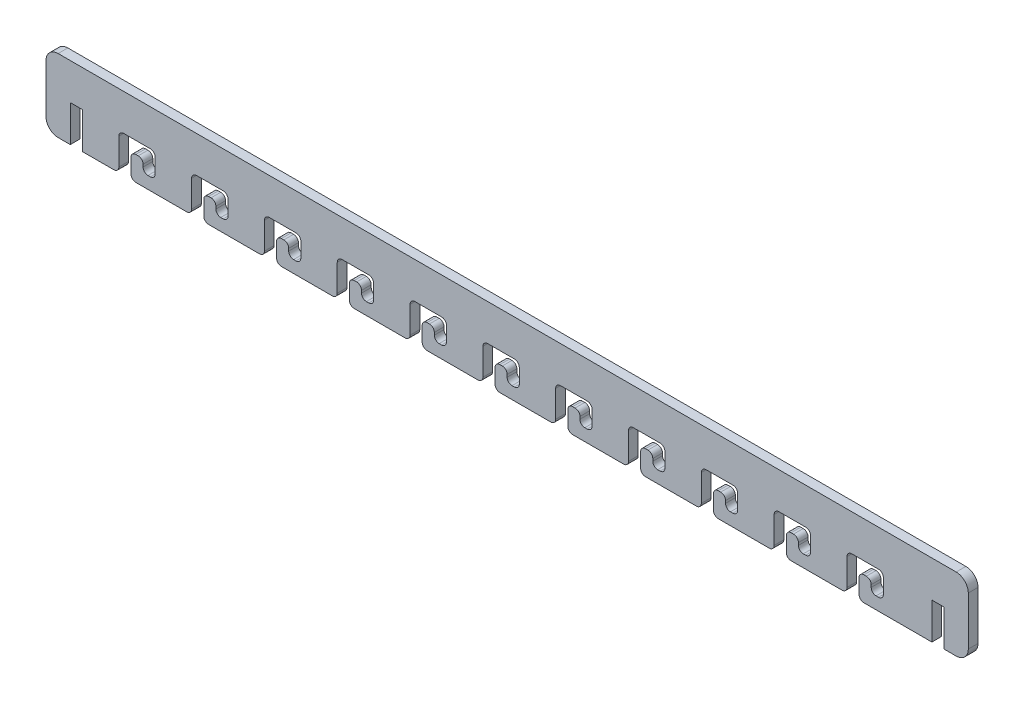
from build123d import *

# Parameters (mm, degrees)
BOSS_EXTRUDE1_DEPTH = 4


with BuildPart() as part:
    # Sketch1 → Boss-Extrude1 (new body)
    with BuildSketch(Plane.XY):
        with BuildLine():
            Line((5, 0), (10, 0))
            Line((10, 0), (10, 15))
            Line((10, 15), (15, 15))
            Line((15, 15), (15, 0))
            Line((15, 0), (28, 0))
            ThreePointArc((28, 0), (29.414213562, 0.585786438), (30, 2))
            Line((30, 2), (30, 13))
            ThreePointArc((30, 13), (30.585786438, 14.414213562), (32, 15))
            Line((32, 15), (43, 15))
            ThreePointArc((43, 15), (44.414213562, 14.414213562), (45, 13))
            Line((45, 13), (45, 7))
            ThreePointArc((45, 7), (44.414213562, 5.585786438), (43, 5))
            Line((43, 5), (42, 5))
            ThreePointArc((42, 5), (40.585786438, 5.585786438), (40, 7))
            Line((40, 7), (40, 8))
            ThreePointArc((40, 8), (39.414213562, 9.414213562), (38, 10))
            Line((38, 10), (37, 10))
            ThreePointArc((37, 10), (35.585786438, 9.414213562), (35, 8))
            Line((35, 8), (35, 2))
            ThreePointArc((35, 2), (35.585786438, 0.585786438), (37, 0))
            Line((37, 0), (58, 0))
            ThreePointArc((58, 0), (59.414213562, 0.585786438), (60, 2))
            Line((60, 2), (60, 13))
            ThreePointArc((60, 13), (60.585786438, 14.414213562), (62, 15))
            Line((62, 15), (73, 15))
            ThreePointArc((73, 15), (74.414213562, 14.414213562), (75, 13))
            Line((75, 13), (75, 7))
            ThreePointArc((75, 7), (74.414213562, 5.585786438), (73, 5))
            Line((73, 5), (72, 5))
            ThreePointArc((72, 5), (70.585786438, 5.585786438), (70, 7))
            Line((70, 7), (70, 8))
            ThreePointArc((70, 8), (69.414213562, 9.414213562), (68, 10))
            Line((68, 10), (67, 10))
            ThreePointArc((67, 10), (65.585786438, 9.414213562), (65, 8))
            Line((65, 8), (65, 2))
            ThreePointArc((65, 2), (65.585786438, 0.585786438), (67, 0))
            Line((67, 0), (88, 0))
            ThreePointArc((88, 0), (89.414213562, 0.585786438), (90, 2))
            Line((90, 2), (90, 13))
            ThreePointArc((90, 13), (90.585786438, 14.414213562), (92, 15))
            Line((92, 15), (103, 15))
            ThreePointArc((103, 15), (104.414213562, 14.414213562), (105, 13))
            Line((105, 13), (105, 7))
            ThreePointArc((105, 7), (104.414213562, 5.585786438), (103, 5))
            Line((103, 5), (102, 5))
            ThreePointArc((102, 5), (100.585786438, 5.585786438), (100, 7))
            Line((100, 7), (100, 8))
            ThreePointArc((100, 8), (99.414213562, 9.414213562), (98, 10))
            Line((98, 10), (97, 10))
            ThreePointArc((97, 10), (95.585786438, 9.414213562), (95, 8))
            Line((95, 8), (95, 2))
            ThreePointArc((95, 2), (95.585786438, 0.585786438), (97, 0))
            Line((97, 0), (118, 0))
            ThreePointArc((118, 0), (119.414213562, 0.585786438), (120, 2))
            Line((120, 2), (120, 13))
            ThreePointArc((120, 13), (120.585786438, 14.414213562), (122, 15))
            Line((122, 15), (133, 15))
            ThreePointArc((133, 15), (134.414213562, 14.414213562), (135, 13))
            Line((135, 13), (135, 7))
            ThreePointArc((135, 7), (134.414213562, 5.585786438), (133, 5))
            Line((133, 5), (132, 5))
            ThreePointArc((132, 5), (130.585786438, 5.585786438), (130, 7))
            Line((130, 7), (130, 8))
            ThreePointArc((130, 8), (129.414213562, 9.414213562), (128, 10))
            Line((128, 10), (127, 10))
            ThreePointArc((127, 10), (125.585786438, 9.414213562), (125, 8))
            Line((125, 8), (125, 2))
            ThreePointArc((125, 2), (125.585786438, 0.585786438), (127, 0))
            Line((127, 0), (148, 0))
            ThreePointArc((148, 0), (149.414213562, 0.585786438), (150, 2))
            Line((150, 2), (150, 13))
            ThreePointArc((150, 13), (150.585786438, 14.414213562), (152, 15))
            Line((152, 15), (163, 15))
            ThreePointArc((163, 15), (164.414213562, 14.414213562), (165, 13))
            Line((165, 13), (165, 7))
            ThreePointArc((165, 7), (164.414213562, 5.585786438), (163, 5))
            Line((163, 5), (162, 5))
            ThreePointArc((162, 5), (160.585786438, 5.585786438), (160, 7))
            Line((160, 7), (160, 8))
            ThreePointArc((160, 8), (159.414213562, 9.414213562), (158, 10))
            Line((158, 10), (157, 10))
            ThreePointArc((157, 10), (155.585786438, 9.414213562), (155, 8))
            Line((155, 8), (155, 2))
            ThreePointArc((155, 2), (155.585786438, 0.585786438), (157, 0))
            Line((157, 0), (178, 0))
            ThreePointArc((178, 0), (179.414213562, 0.585786438), (180, 2))
            Line((180, 2), (180, 13))
            ThreePointArc((180, 13), (180.585786438, 14.414213562), (182, 15))
            Line((182, 15), (193, 15))
            ThreePointArc((193, 15), (194.414213562, 14.414213562), (195, 13))
            Line((195, 13), (195, 7))
            ThreePointArc((195, 7), (194.414213562, 5.585786438), (193, 5))
            Line((193, 5), (192, 5))
            ThreePointArc((192, 5), (190.585786438, 5.585786438), (190, 7))
            Line((190, 7), (190, 8))
            ThreePointArc((190, 8), (189.414213562, 9.414213562), (188, 10))
            Line((188, 10), (187, 10))
            ThreePointArc((187, 10), (185.585786438, 9.414213562), (185, 8))
            Line((185, 8), (185, 2))
            ThreePointArc((185, 2), (185.585786438, 0.585786438), (187, 0))
            Line((187, 0), (208, 0))
            ThreePointArc((208, 0), (209.414213562, 0.585786438), (210, 2))
            Line((210, 2), (210, 13))
            ThreePointArc((210, 13), (210.585786438, 14.414213562), (212, 15))
            Line((212, 15), (223, 15))
            ThreePointArc((223, 15), (224.414213562, 14.414213562), (225, 13))
            Line((225, 13), (225, 7))
            ThreePointArc((225, 7), (224.414213562, 5.585786438), (223, 5))
            Line((223, 5), (222, 5))
            ThreePointArc((222, 5), (220.585786438, 5.585786438), (220, 7))
            Line((220, 7), (220, 8))
            ThreePointArc((220, 8), (219.414213562, 9.414213562), (218, 10))
            Line((218, 10), (217, 10))
            ThreePointArc((217, 10), (215.585786438, 9.414213562), (215, 8))
            Line((215, 8), (215, 2))
            ThreePointArc((215, 2), (215.585786438, 0.585786438), (217, 0))
            Line((217, 0), (238, 0))
            ThreePointArc((238, 0), (239.414213562, 0.585786438), (240, 2))
            Line((240, 2), (240, 13))
            ThreePointArc((240, 13), (240.585786438, 14.414213562), (242, 15))
            Line((242, 15), (253, 15))
            ThreePointArc((253, 15), (254.414213562, 14.414213562), (255, 13))
            Line((255, 13), (255, 7))
            ThreePointArc((255, 7), (254.414213562, 5.585786438), (253, 5))
            Line((253, 5), (252, 5))
            ThreePointArc((252, 5), (250.585786438, 5.585786438), (250, 7))
            Line((250, 7), (250, 8))
            ThreePointArc((250, 8), (249.414213562, 9.414213562), (248, 10))
            Line((248, 10), (247, 10))
            ThreePointArc((247, 10), (245.585786438, 9.414213562), (245, 8))
            Line((245, 8), (245, 2))
            ThreePointArc((245, 2), (245.585786438, 0.585786438), (247, 0))
            Line((247, 0), (268, 0))
            ThreePointArc((268, 0), (269.414213562, 0.585786438), (270, 2))
            Line((270, 2), (270, 13))
            ThreePointArc((270, 13), (270.585786438, 14.414213562), (272, 15))
            Line((272, 15), (283, 15))
            ThreePointArc((283, 15), (284.414213562, 14.414213562), (285, 13))
            Line((285, 13), (285, 7))
            ThreePointArc((285, 7), (284.414213562, 5.585786438), (283, 5))
            Line((283, 5), (282, 5))
            ThreePointArc((282, 5), (280.585786438, 5.585786438), (280, 7))
            Line((280, 7), (280, 8))
            ThreePointArc((280, 8), (279.414213562, 9.414213562), (278, 10))
            Line((278, 10), (277, 10))
            ThreePointArc((277, 10), (275.585786438, 9.414213562), (275, 8))
            Line((275, 8), (275, 2))
            ThreePointArc((275, 2), (275.585786438, 0.585786438), (277, 0))
            Line((277, 0), (298, 0))
            ThreePointArc((298, 0), (299.414213562, 0.585786438), (300, 2))
            Line((300, 2), (300, 13))
            ThreePointArc((300, 13), (300.585786438, 14.414213562), (302, 15))
            Line((302, 15), (313, 15))
            ThreePointArc((313, 15), (314.414213562, 14.414213562), (315, 13))
            Line((315, 13), (315, 7))
            ThreePointArc((315, 7), (314.414213562, 5.585786438), (313, 5))
            Line((313, 5), (312, 5))
            ThreePointArc((312, 5), (310.585786438, 5.585786438), (310, 7))
            Line((310, 7), (310, 8))
            ThreePointArc((310, 8), (309.414213562, 9.414213562), (308, 10))
            Line((308, 10), (307, 10))
            ThreePointArc((307, 10), (305.585786438, 9.414213562), (305, 8))
            Line((305, 8), (305, 2))
            ThreePointArc((305, 2), (305.585786438, 0.585786438), (307, 0))
            Line((307, 0), (328, 0))
            ThreePointArc((328, 0), (329.414213562, 0.585786438), (330, 2))
            Line((330, 2), (330, 13))
            ThreePointArc((330, 13), (330.585786438, 14.414213562), (332, 15))
            Line((332, 15), (343, 15))
            ThreePointArc((343, 15), (344.414213562, 14.414213562), (345, 13))
            Line((345, 13), (345, 7))
            ThreePointArc((345, 7), (344.414213562, 5.585786438), (343, 5))
            Line((343, 5), (342, 5))
            ThreePointArc((342, 5), (340.585786438, 5.585786438), (340, 7))
            Line((340, 7), (340, 8))
            ThreePointArc((340, 8), (339.414213562, 9.414213562), (338, 10))
            Line((338, 10), (337, 10))
            ThreePointArc((337, 10), (335.585786438, 9.414213562), (335, 8))
            Line((335, 8), (335, 2))
            ThreePointArc((335, 2), (335.585786438, 0.585786438), (337, 0))
            Line((337, 0), (365, 0))
            Line((365, 0), (365, 15))
            Line((365, 15), (370, 15))
            Line((370, 15), (370, 0))
            Line((370, 0), (375, 0))
            ThreePointArc((375, 0), (378.535533906, 1.464466094), (380, 5))
            Line((380, 5), (380, 25))
            ThreePointArc((380, 25), (378.535533906, 28.535533906), (375, 30))
            Line((375, 30), (5, 30))
            ThreePointArc((5, 30), (1.464466094, 28.535533906), (0, 25))
            Line((0, 25), (0, 5))
            ThreePointArc((0, 5), (1.464466094, 1.464466094), (5, 0))
        make_face()
    extrude(amount=BOSS_EXTRUDE1_DEPTH)


solid = part.part
